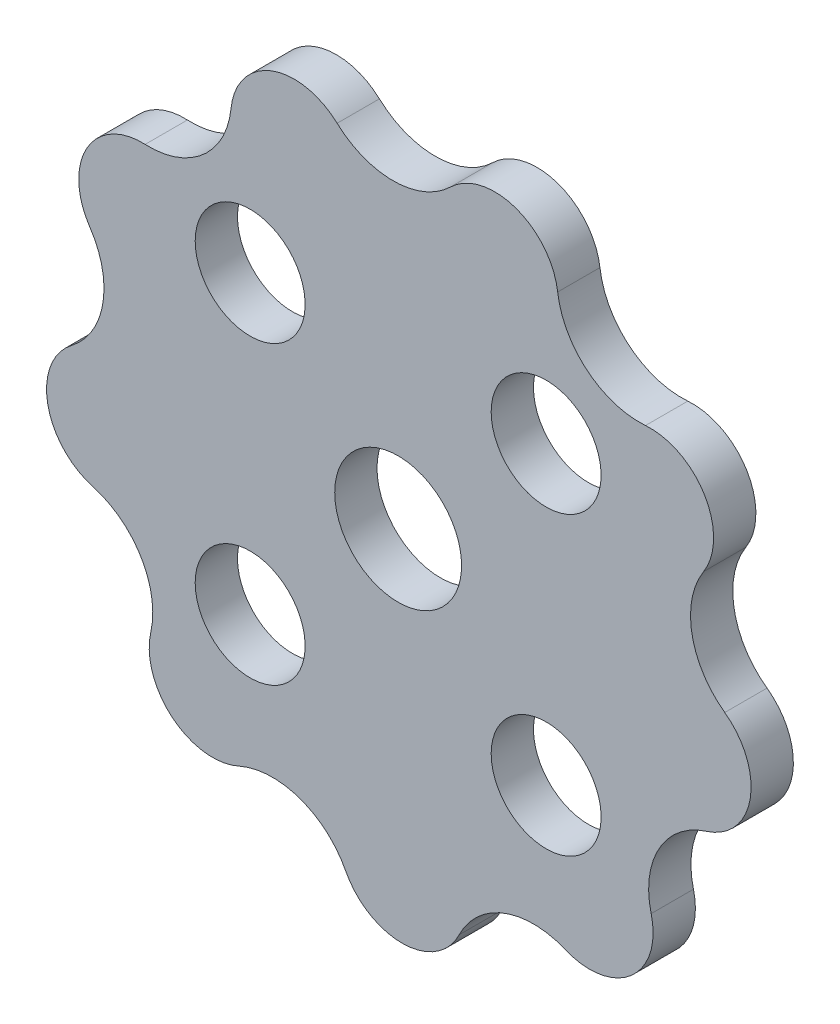
from build123d import *

# Parameters (mm, degrees)
BOSS_EXTRUDE1_DEPTH = 10
SKETCH3_R           = 13
SKETCH3_R_2         = 15
CUT_EXTRUDE1_DEPTH  = 120.101165428


with BuildPart() as part:
    # Sketch1 → Boss-Extrude1 (new body)
    with BuildSketch(Plane.XY):
        with BuildLine():
            ThreePointArc((-14.43044528, 75.890215107), (-0.949427503, 70.727267405), (12.388145038, 76.250222049))
            ThreePointArc((12.388145038, 76.250222049), (27.789798404, 79.662981363), (37.726927549, 67.410988998))
            ThreePointArc((37.726927549, 67.410988998), (44.735307492, 54.790510408), (58.502567636, 50.44811275))
            ThreePointArc((58.502567636, 50.44811275), (72.494598013, 43.162446106), (72.23145169, 27.389411947))
            ThreePointArc((72.23145169, 27.389411947), (69.487894935, 13.216664662), (77.242988653, 1.040770827))
            ThreePointArc((77.242988653, 1.040770827), (83.278369525, -13.534277382), (72.938076822, -25.447975353))
            ThreePointArc((72.938076822, -25.447975353), (61.726324065, -34.541405366), (59.84055682, -48.853559333))
            ThreePointArc((59.84055682, -48.853559333), (55.0952664, -63.898162065), (39.516165192, -66.377972163))
            ThreePointArc((39.516165192, -66.377972163), (25.082320154, -66.137167939), (14.438063397, -75.888766134))
            ThreePointArc((14.438063397, -75.888766134), (1.13247581, -84.36338657), (-12.395799304, -76.248978089))
            ThreePointArc((-12.395799304, -76.248978089), (-23.297980116, -66.7866146), (-37.720160351, -67.414775851))
            ThreePointArc((-37.720160351, -67.414775851), (-53.360212797, -65.354044903), (-58.507631542, -50.442239754))
            ThreePointArc((-58.507631542, -50.442239754), (-60.776896562, -36.185862039), (-72.228701857, -27.396662716))
            ThreePointArc((-72.228701857, -27.396662716), (-82.885064803, -15.764819298), (-77.243092741, -1.033016835))
            ThreePointArc((-77.243092741, -1.033016835), (-69.817627646, 11.34665753), (-72.940631032, 25.440653384))
            ThreePointArc((-72.940631032, 25.440653384), (-73.627073824, 41.200940464), (-59.835652386, 48.859566142))
            ThreePointArc((-59.835652386, 48.859566142), (-46.189914818, 53.569949938), (-39.522828302, 66.374005024))
            ThreePointArc((-39.522828302, 66.374005024), (-29.918156728, 78.888322285), (-14.43044528, 75.890215107))
        make_face()
    extrude(amount=BOSS_EXTRUDE1_DEPTH)

    # Sketch3 → Cut-Extrude1 (cut, through all)
    with BuildSketch(Plane(origin=(0, 0, 0), x_dir=(-1, 0, 0), z_dir=(0, 0, -1))):
        with Locations((-35, 35)):
            Circle(SKETCH3_R)
        with Locations((35, 35)):
            Circle(SKETCH3_R)
        with Locations((35, -35)):
            Circle(SKETCH3_R)
        with Locations((-35, -35)):
            Circle(SKETCH3_R)
        Circle(SKETCH3_R_2)
    extrude(amount=-CUT_EXTRUDE1_DEPTH, mode=Mode.SUBTRACT)


solid = part.part
